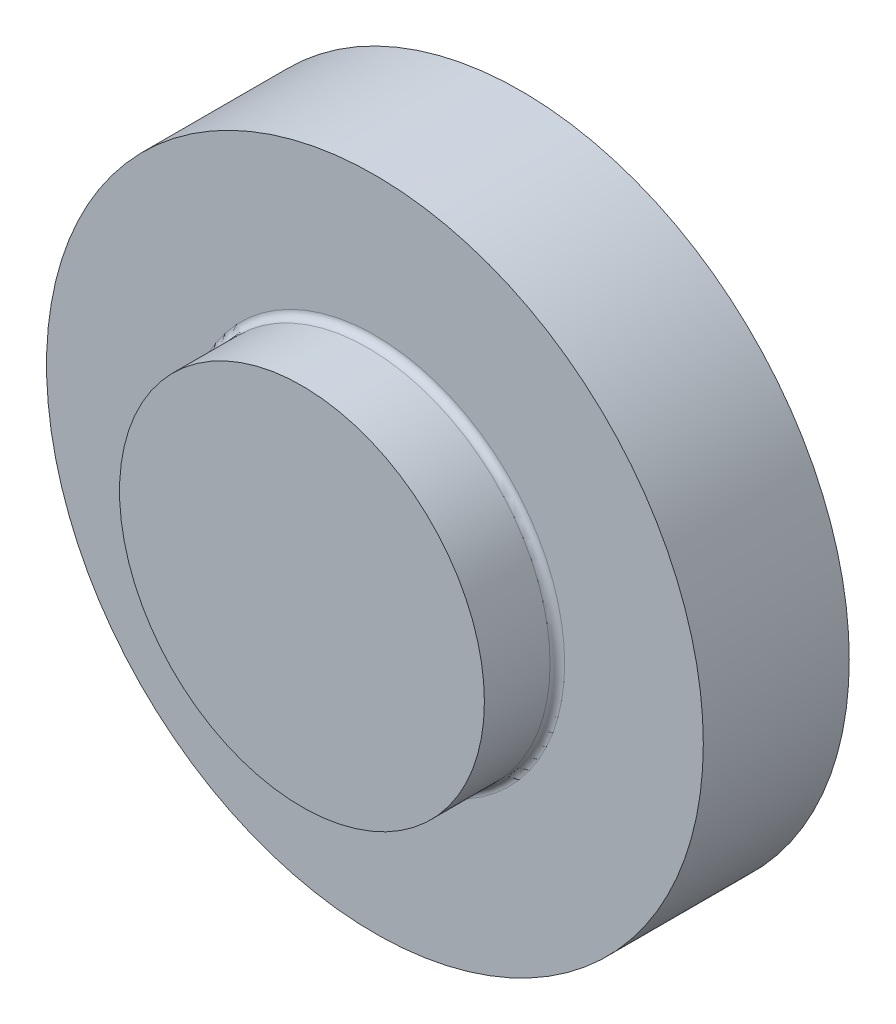
from build123d import *

# Parameters (mm, degrees)
SKETCH1_R           = 90
BOSS_EXTRUDE1_DEPTH = 40
SKETCH2_R           = 50
BOSS_EXTRUDE2_DEPTH = 20
FILLET1_R           = 2


with BuildPart() as part:
    # Sketch1 → Boss-Extrude1 (new body)
    with BuildSketch(Plane.XY):
        Circle(SKETCH1_R)
    extrude(amount=BOSS_EXTRUDE1_DEPTH)

    # Sketch2 → Boss-Extrude2 (add)
    with BuildSketch(Plane.XY.offset(40)):
        Circle(SKETCH2_R)
    extrude(amount=BOSS_EXTRUDE2_DEPTH)

    # Fillet1
    fillet1_edges = [part.edges().sort_by_distance(p)[0] for p in [
        (-50, 0, 40),
    ]]
    fillet(fillet1_edges, radius=FILLET1_R)


solid = part.part
